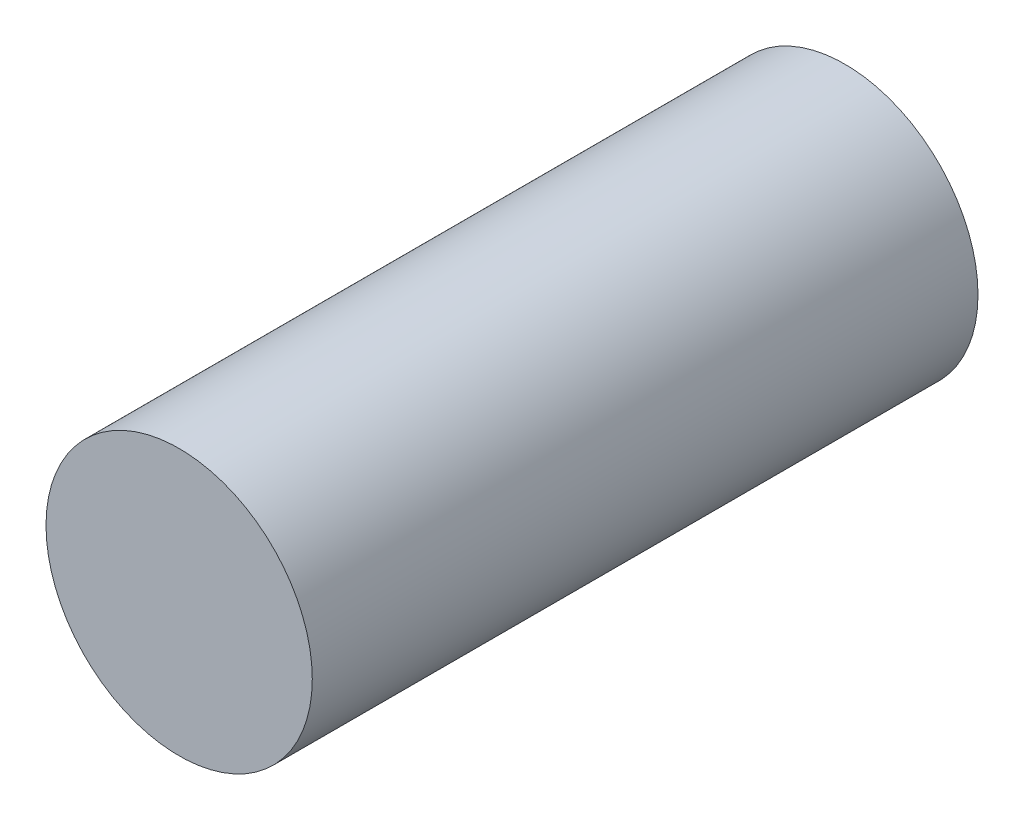
from build123d import *

# Parameters (mm, degrees)
ESBO_O1_R                = 2
RESSALTO_EXTRUS_O1_DEPTH = 10


with BuildPart() as part:
    # Esboço1 → Ressalto-extrusão1 (new body)
    with BuildSketch(Plane.XY):
        Circle(ESBO_O1_R)
    extrude(amount=RESSALTO_EXTRUS_O1_DEPTH)


solid = part.part
